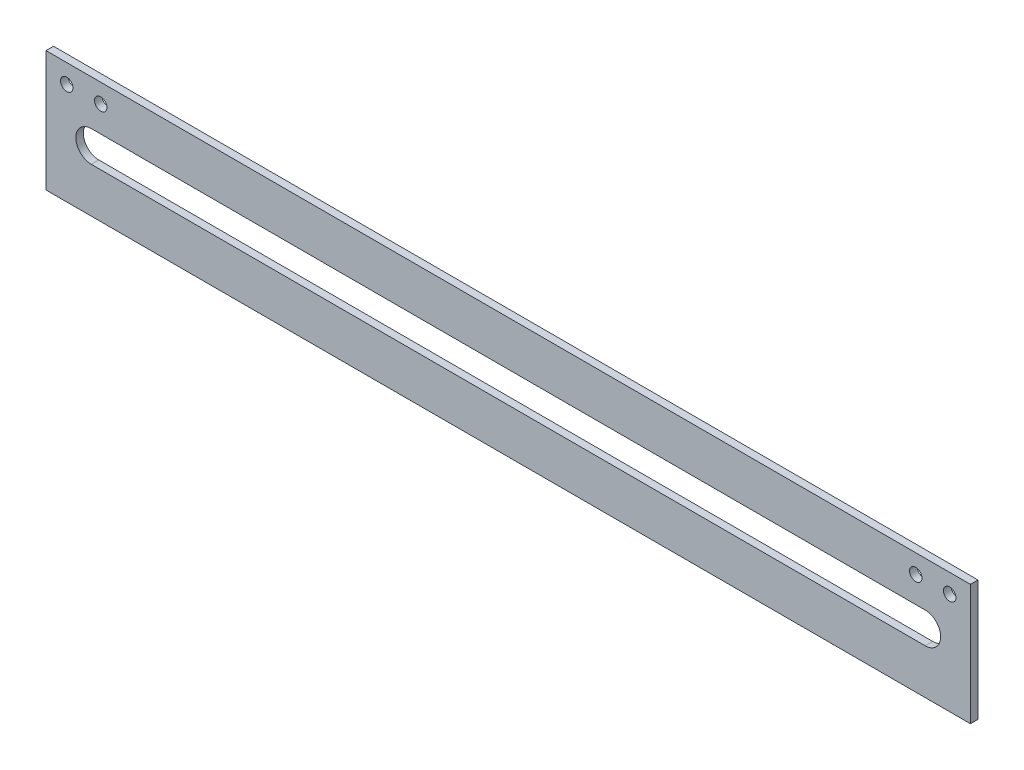
from build123d import *

# Parameters (mm, degrees)
SKETCH_1_W      = 245
SKETCH_1_H      = 32
SKETCH_1_R      = 1.65
EXTRUDE_1_DEPTH = 2


with BuildPart() as part:
    # 草图1 → 凸台-拉伸1 (new body)
    with BuildSketch(Plane.XY):
        with Locations((122.5, 16)):
            Rectangle(SKETCH_1_W, SKETCH_1_H)
        with Locations((14.5, 27)):
            Circle(SKETCH_1_R, mode=Mode.SUBTRACT)
        with Locations((5.5, 27)):
            Circle(SKETCH_1_R, mode=Mode.SUBTRACT)
        with Locations((230.5, 27)):
            Circle(SKETCH_1_R, mode=Mode.SUBTRACT)
        with Locations((239.5, 27)):
            Circle(SKETCH_1_R, mode=Mode.SUBTRACT)
        with BuildLine():
            Line((12, 20.1), (233, 20.1))
            ThreePointArc((233, 20.1), (237.1, 16), (233, 11.9))
            Line((233, 11.9), (12, 11.9))
            ThreePointArc((12, 11.9), (7.9, 16), (12, 20.1))
        make_face(mode=Mode.SUBTRACT)
    extrude(amount=EXTRUDE_1_DEPTH)


solid = part.part
